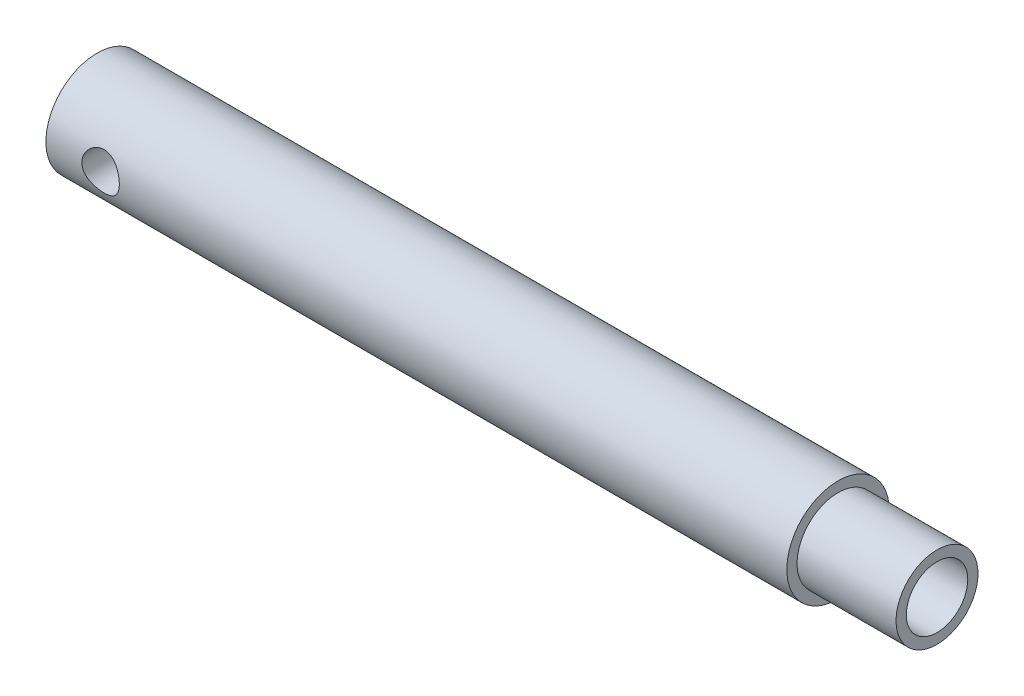
from build123d import *

# Parameters (mm, degrees)
FURO_DE_DI_METRO_5_5_5_5_1_REACH  = 126.138
FURO_DE_DI_METRO_5_5_5_5_1_BORE_R = 2.75


with BuildPart() as part:
    # Esboço1 → Revolução1 (revolve)
    with BuildSketch(Plane.XY, mode=Mode.PRIVATE) as revolu_o1_sk:
        Polygon((0, 3.5), (0, 7.5), (108.5, 7.5), (108.5, 6), (123, 6), (123, 4.5), (100, 4.5), (100, 4), (11, 4), (11, 3.5), align=None)
    revolve(revolu_o1_sk.sketch.rotate(Axis((123, 0, 0), (-1, 0, 0)), 90), axis=Axis((123, 0, 0), (-1, 0, 0)))

    # Furo de diâmetro Ø5.5 (5.5)1 bore → Furo de diâmetro Ø5.5 (5.5)1 (cut, up to next)
    with BuildSketch(Plane(origin=(0, 0, -7.5), x_dir=(-1, 0, 0), z_dir=(0, 0, -1)), mode=Mode.PRIVATE) as furo_de_di_metro_5_5_5_5_1_sk1:
        with Locations((-8, 0)):
            Circle(FURO_DE_DI_METRO_5_5_5_5_1_BORE_R)
    furo_de_di_metro_5_5_5_5_1_tool1 = extrude(furo_de_di_metro_5_5_5_5_1_sk1.sketch, amount=-FURO_DE_DI_METRO_5_5_5_5_1_REACH, mode=Mode.PRIVATE) & part.part
    furo_de_di_metro_5_5_5_5_1 = furo_de_di_metro_5_5_5_5_1_tool1.solids().sort_by_distance((8, 0, -7.5))[0]
    add(furo_de_di_metro_5_5_5_5_1, mode=Mode.SUBTRACT)

    # Espelhar1: Furo de diâmetro Ø5.5 (5.5)1 across plane
    add(furo_de_di_metro_5_5_5_5_1.mirror(Plane.XY), mode=Mode.SUBTRACT)


solid = part.part
